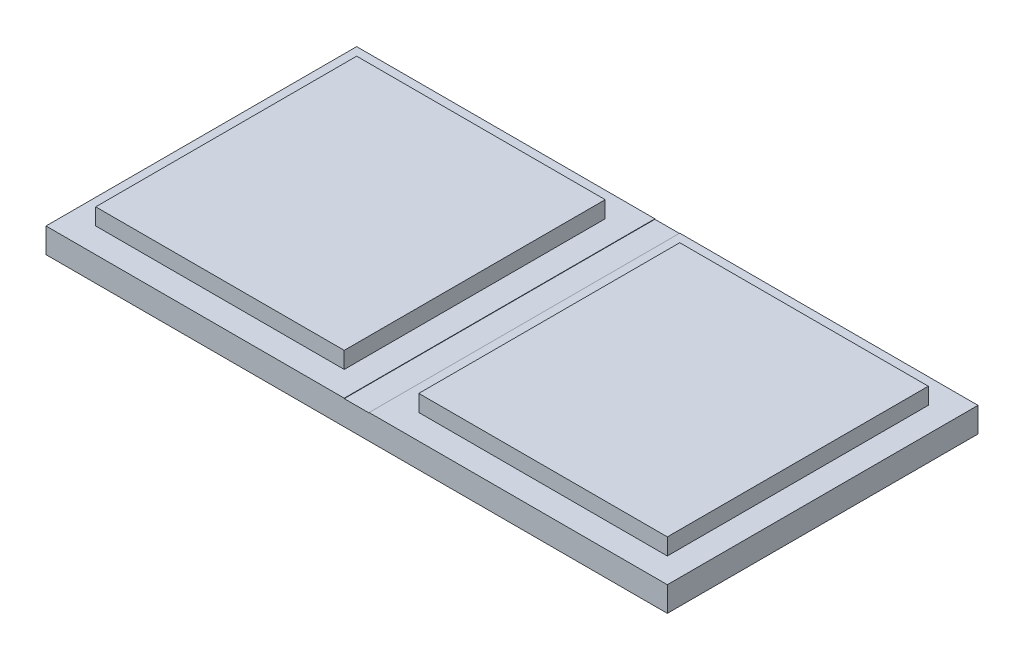
from build123d import *

# Parameters (mm, degrees)
SKETCH1_W           = 30
SKETCH1_H           = 15
BOSS_EXTRUDE1_DEPTH = 1.2
SKETCH2_W           = 1.2
SKETCH2_H           = 15
CUT_EXTRUDE1_DEPTH  = 0.02
SKETCH3_W           = 12
SKETCH3_H           = 12.6
BOSS_EXTRUDE2_DEPTH = 0.8
SKETCH4_W           = 12
SKETCH4_H           = 12.6
BOSS_EXTRUDE3_DEPTH = 0.8


with BuildPart() as part:
    # Sketch1 → Boss-Extrude1 (new body)
    with BuildSketch(Plane(origin=(0, 0, 0), x_dir=(1, 0, 0), z_dir=(0, 1, 0))):
        Rectangle(SKETCH1_W, SKETCH1_H)
    extrude(amount=BOSS_EXTRUDE1_DEPTH)

    # Sketch2 → Cut-Extrude1 (cut)
    with BuildSketch(Plane(origin=(0, 1.2, 0), x_dir=(1, 0, 0), z_dir=(0, 1, 0))):
        Rectangle(SKETCH2_W, SKETCH2_H)
    extrude(amount=-CUT_EXTRUDE1_DEPTH, mode=Mode.SUBTRACT)

    # Sketch3 → Boss-Extrude2 (add)
    with BuildSketch(Plane(origin=(0, 1.2, 0), x_dir=(1, 0, 0), z_dir=(0, 1, 0))):
        with Locations((-7.8, 0)):
            Rectangle(SKETCH3_W, SKETCH3_H)
    extrude(amount=BOSS_EXTRUDE2_DEPTH)

    # Sketch4 → Boss-Extrude3 (add)
    with BuildSketch(Plane(origin=(0, 1.2, 0), x_dir=(1, 0, 0), z_dir=(0, 1, 0))):
        with Locations((7.8, 0)):
            Rectangle(SKETCH4_W, SKETCH4_H)
    extrude(amount=BOSS_EXTRUDE3_DEPTH)


solid = part.part
